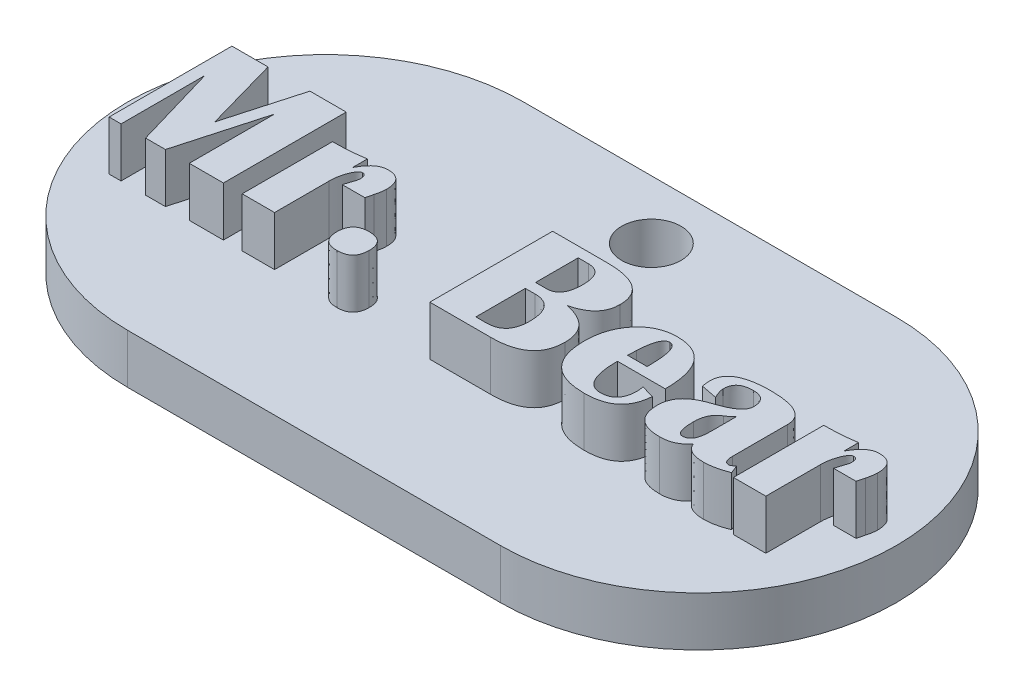
from build123d import *

# Parameters (mm, degrees)
BOSS_EXTRUDE1_DEPTH = 2.5
BOSS_EXTRUDE2_DEPTH = 2.5
SKETCH3_R           = 1.5
CUT_EXTRUDE1_DEPTH  = 5


with BuildPart() as part:
    # Sketch1 → Boss-Extrude1 (new body)
    with BuildSketch(Plane(origin=(0, 0, 0), x_dir=(1, 0, 0), z_dir=(0, 1, 0))):
        with BuildLine():
            Line((-9.422676429, 10), (9.422676429, 10))
            ThreePointArc((9.422676429, 10), (19.422676429, 0), (9.422676429, -10))
            Line((9.422676429, -10), (-9.422676429, -10))
            ThreePointArc((-9.422676429, -10), (-19.422676429, 0), (-9.422676429, 10))
        make_face()
    extrude(amount=BOSS_EXTRUDE1_DEPTH)

    # Sketch2 → Boss-Extrude2 (add)
    # profile 1 of 7: a face of its own
    with BuildSketch(Plane(origin=(0, 2.5, 0), x_dir=(1, 0, 0), z_dir=(0, 1, 0))):
        Polygon((-10.955316589, 2.576236371), (-10.955316589, -3.631136676), (-12.67958688, -3.631136676), (-12.67958688, 0.675497793), (-13.886576084, -3.631136676), (-14.88880819, -3.631136676), (-16.128127462, 0.60275514), (-16.128127462, -3.631136676), (-16.731622064, -3.631136676), (-16.731622064, 2.576236371), (-14.907667397, 2.576236371), (-13.846163499, -1.17809277), (-12.788700859, 2.576236371), align=None)
    # profile 2 of 7: a face of its own
    with BuildSketch(Plane(origin=(0, 2.5, 0), x_dir=(1, 0, 0), z_dir=(0, 1, 0))):
        with BuildLine():
            Line((-6.741631066, -0.699877181), (-7.877224703, -0.699877181))
            add(Edge.make_bspline(
                [(-7.877224703, -0.699877181), (-7.866266297, -0.657594595), (-7.845790087, -0.578587933), (-7.813482695, -0.470000398), (-7.783924156, -0.378768381), (-7.763776991, -0.324434196), (-7.754639862, -0.299792591)],
                knots=[0, 0, 0, 0, 1.251870671, 2.339169178, 3.246781061, 4, 4, 4, 4], degree=3))
            add(Edge.make_bspline(
                [(-7.754639862, -0.299792591), (-7.742697607, -0.269486036), (-7.719680733, -0.211074776), (-7.697870442, -0.122646379), (-7.681112749, -0.039539853), (-7.679822227, 0.014900048), (-7.679203037, 0.041020209)],
                knots=[0, 0, 0, 0, 1.111698743, 2.142629759, 3.108837303, 4, 4, 4, 4], degree=3))
            add(Edge.make_bspline(
                [(-7.679203037, 0.041020209), (-7.680158435, 0.063931728), (-7.681947024, 0.106824093), (-7.690334299, 0.167562968), (-7.708349143, 0.21853118), (-7.730203199, 0.262426953), (-7.763190598, 0.294385253), (-7.801882853, 0.317598334), (-7.847321597, 0.333448773), (-7.880226387, 0.334260548), (-7.897430996, 0.334684993)],
                knots=[0, 0, 0, 0, 1.321191862, 2.473386612, 3.512021293, 4.426346394, 5.267525488, 6.114646584, 7.014223539, 8, 8, 8, 8], degree=3))
            add(Edge.make_bspline(
                [(-7.897430996, 0.334684993), (-7.911595386, 0.333837006), (-7.940762009, 0.332090872), (-7.981879333, 0.31030395), (-8.02357568, 0.280354874), (-8.062789257, 0.235988851), (-8.104282682, 0.181902611), (-8.141784082, 0.113831675), (-8.18189658, 0.035383943), (-8.230640107, -0.08666944), (-8.285684574, -0.249179868), (-8.334860442, -0.452278728), (-8.36342281, -0.661337241), (-8.367074976, -0.802619619), (-8.368911153, -0.873651297)],
                knots=[0, 0, 0, 0, 0.36974167, 0.761354033, 1.201421396, 1.720285529, 2.311739729, 2.995477158, 3.762545601, 4.632445855, 6.4541632, 8.278912041, 10.129171368, 12, 12, 12, 12], degree=3))
            Line((-8.368911153, -0.873651297), (-8.368911153, -3.631136676))
            Line((-8.368911153, -3.631136676), (-10.006967929, -3.631136676))
            Line((-10.006967929, -3.631136676), (-10.006967929, 0.938179595))
            Line((-10.006967929, 0.938179595), (-9.687708508, 0.938179595))
            add(Edge.make_bspline(
                [(-9.687708508, 0.938179595), (-9.589789707, 0.940083265), (-9.385663946, 0.944051738), (-9.067423605, 0.966349628), (-8.725530989, 1.004287756), (-8.490486166, 1.039735307), (-8.368911153, 1.058070263)],
                knots=[0, 0, 0, 0, 0.886555129, 1.848151092, 2.886973752, 4, 4, 4, 4], degree=3))
            Line((-8.368911153, 1.058070263), (-8.368911153, 0.311784528))
            add(Edge.make_bspline(
                [(-8.368911153, 0.311784528), (-8.335163673, 0.374967931), (-8.270523242, 0.49599037), (-8.157440897, 0.657746918), (-8.041931227, 0.79754977), (-7.91906082, 0.911673641), (-7.78984828, 1.001717412), (-7.653649459, 1.063554207), (-7.512260039, 1.104287451), (-7.415451518, 1.108489578), (-7.366679047, 1.110606624)],
                knots=[0, 0, 0, 0, 1.271492001, 2.435434869, 3.499734799, 4.487660404, 5.405912591, 6.283991741, 7.135469055, 8, 8, 8, 8], degree=3))
            add(Edge.make_bspline(
                [(-7.366679047, 1.110606624), (-7.30306682, 1.108635746), (-7.182694934, 1.104906301), (-7.014998945, 1.060829917), (-6.871999996, 0.990544793), (-6.75425699, 0.890004991), (-6.664458768, 0.759754148), (-6.601238245, 0.602046015), (-6.563917038, 0.417236773), (-6.560331946, 0.285029898), (-6.558427348, 0.214794324)],
                knots=[0, 0, 0, 0, 1.102396871, 2.086039073, 2.985883286, 3.848703023, 4.744448623, 5.706110886, 6.781359763, 8, 8, 8, 8], degree=3))
            add(Edge.make_bspline(
                [(-6.558427348, 0.214794324), (-6.559537778, 0.173884013), (-6.561839726, 0.089075965), (-6.579172873, -0.04187984), (-6.606090984, -0.181360579), (-6.631458604, -0.276136838), (-6.644640862, -0.325387228)],
                knots=[0, 0, 0, 0, 0.894643577, 1.854617404, 2.885154048, 4, 4, 4, 4], degree=3))
            add(Edge.make_bspline(
                [(-6.644640862, -0.325387228), (-6.650500364, -0.348731), (-6.66357156, -0.40080557), (-6.68458333, -0.486826056), (-6.712281825, -0.587993964), (-6.731378273, -0.660792169), (-6.741631066, -0.699877181)],
                knots=[0, 0, 0, 0, 0.746575748, 1.665438207, 2.746584817, 4, 4, 4, 4], degree=3))
        make_face()
    # profile 3 of 7: a face of its own
    with BuildSketch(Plane(origin=(0, 2.5, 0), x_dir=(1, 0, 0), z_dir=(0, 1, 0))):
        with BuildLine():
            add(Edge.make_bspline(
                [(-5.135904358, -2.079293414), (-5.071417442, -2.080957857), (-4.950054454, -2.084090303), (-4.781097018, -2.124588156), (-4.635250998, -2.186245009), (-4.517800496, -2.280217941), (-4.423827564, -2.397668443), (-4.362170712, -2.543514463), (-4.321672859, -2.712471899), (-4.318540413, -2.833834886), (-4.31687597, -2.898321802)],
                knots=[0, 0, 0, 0, 1.162714133, 2.188202964, 3.121723856, 4, 4.878276144, 5.811797036, 6.837285867, 8, 8, 8, 8], degree=3))
            add(Edge.make_bspline(
                [(-4.31687597, -2.898321802), (-4.318657232, -2.962324235), (-4.322032737, -3.083609285), (-4.361489793, -3.252545475), (-4.424749706, -3.397871726), (-4.516785012, -3.516621154), (-4.6361708, -3.608414297), (-4.780425288, -3.673008939), (-4.950411479, -3.710235542), (-5.071497018, -3.714879823), (-5.135904358, -3.71735019)],
                knots=[0, 0, 0, 0, 1.155216392, 2.189142997, 3.115745179, 4.000869033, 4.874599507, 5.811952642, 6.83614253, 8, 8, 8, 8], degree=3))
            add(Edge.make_bspline(
                [(-5.135904358, -3.71735019), (-5.199828289, -3.714767133), (-5.320837161, -3.709877369), (-5.49080251, -3.673690187), (-5.634536029, -3.607490747), (-5.755218428, -3.517635872), (-5.845073302, -3.396953473), (-5.911272743, -3.253219955), (-5.947459925, -3.083254606), (-5.952349688, -2.962245733), (-5.954932746, -2.898321802)],
                knots=[0, 0, 0, 0, 1.156336832, 2.18896139, 3.119402066, 4, 4.880597934, 5.81103861, 6.843663168, 8, 8, 8, 8], degree=3))
            add(Edge.make_bspline(
                [(-5.954932746, -2.898321802), (-5.952462379, -2.833914463), (-5.947818098, -2.712828923), (-5.910591494, -2.542842733), (-5.845996853, -2.398588244), (-5.75420371, -2.279202456), (-5.635454282, -2.18716715), (-5.49012803, -2.123907238), (-5.321191841, -2.084450182), (-5.199906791, -2.081074677), (-5.135904358, -2.079293414)],
                knots=[0, 0, 0, 0, 1.16385747, 2.188047358, 3.125400493, 3.999130967, 4.884254821, 5.810857003, 6.844783608, 8, 8, 8, 8], degree=3))
        make_face()
    # profile 4 of 7: a face of its own
    with BuildSketch(Plane(origin=(0, 2.5, 0), x_dir=(1, 0, 0), z_dir=(0, 1, 0))):
        with BuildLine():
            Line((-0.52348133, -3.631136676), (-0.52348133, 2.576236371))
            Line((-0.52348133, 2.576236371), (2.246127825, 2.576236371))
            add(Edge.make_bspline(
                [(2.246127825, 2.576236371), (2.332822825, 2.575382109), (2.500566459, 2.573729223), (2.74387325, 2.555949905), (2.970705977, 2.526966301), (3.180807769, 2.48522823), (3.374424062, 2.433519855), (3.550795245, 2.368709733), (3.710809607, 2.292027457), (3.85412061, 2.203170756), (3.981133613, 2.102756161), (4.091164296, 1.990058123), (4.185090561, 1.865445831), (4.260752136, 1.728327008), (4.319023837, 1.579653141), (4.360348188, 1.419555262), (4.386792733, 1.247538514), (4.389365224, 1.128668872), (4.390688999, 1.067499867)],
                knots=[0, 0, 0, 0, 1.395221753, 2.699573992, 3.924173681, 5.073721882, 6.145013494, 7.146600138, 8.09374359, 8.996236064, 9.855223683, 10.693435575, 11.524606832, 12.359290184, 13.206182017, 14.087975928, 15.016093518, 16, 16, 16, 16], degree=3))
            add(Edge.make_bspline(
                [(4.390688999, 1.067499867), (4.389552714, 1.023908944), (4.387320338, 0.938269068), (4.372787543, 0.812804786), (4.346683481, 0.693515252), (4.311955026, 0.579593326), (4.266203862, 0.471516011), (4.209235688, 0.370214296), (4.142551889, 0.275300672), (4.066683142, 0.185694365), (3.980285357, 0.101943664), (3.882898004, 0.025328437), (3.775699365, -0.044719298), (3.659176494, -0.109642232), (3.532441779, -0.169164126), (3.394653214, -0.220743878), (3.247546167, -0.268895806), (3.144831359, -0.293761871), (3.092097936, -0.306528021)],
                knots=[0, 0, 0, 0, 1.011382104, 1.986987923, 2.924876173, 3.840928976, 4.746495918, 5.641999688, 6.532154942, 7.433878611, 8.3621711, 9.318848767, 10.304140316, 11.330171245, 12.411412872, 13.549050058, 14.741690871, 16, 16, 16, 16], degree=3))
            add(Edge.make_bspline(
                [(3.092097936, -0.306528021), (3.155148122, -0.320135927), (3.278082854, -0.34666851), (3.454850356, -0.398189553), (3.619702642, -0.457170987), (3.772398729, -0.524557007), (3.9129344, -0.599522436), (4.040622359, -0.683911553), (4.156379775, -0.775441327), (4.262054794, -0.874192833), (4.353040994, -0.983286627), (4.43184152, -1.100557978), (4.499534713, -1.224809238), (4.55536055, -1.357298033), (4.596211053, -1.498616065), (4.62804701, -1.647015615), (4.644884213, -1.804104079), (4.647825694, -1.911322285), (4.649329542, -1.966138176)],
                knots=[0, 0, 0, 0, 1.235430986, 2.408833129, 3.52452697, 4.587536939, 5.603669279, 6.572374558, 7.515532169, 8.42830491, 9.338113503, 10.230469559, 11.131245034, 12.045111669, 12.978687021, 13.945442232, 14.949596169, 16, 16, 16, 16], degree=3))
            add(Edge.make_bspline(
                [(4.649329542, -1.966138176), (4.647829457, -2.033557437), (4.644918896, -2.164368609), (4.620999259, -2.354129966), (4.578443148, -2.530218433), (4.522931506, -2.694600979), (4.448210031, -2.845191541), (4.356869329, -2.982061455), (4.251451448, -3.107695511), (4.12751548, -3.218963516), (3.986207771, -3.315272034), (3.830212307, -3.401482255), (3.656950747, -3.47152895), (3.468483485, -3.531607478), (3.263247588, -3.576593406), (3.041755409, -3.608569403), (2.804140991, -3.62719962), (2.64040835, -3.629796992), (2.555957642, -3.631136676)],
                knots=[0, 0, 0, 0, 1.058454713, 2.05368167, 2.995976372, 3.89904755, 4.7724843, 5.627048632, 6.477472636, 7.34115065, 8.233004837, 9.157537641, 10.134336842, 11.162317281, 12.260511776, 13.429147083, 14.673994716, 16, 16, 16, 16], degree=3))
            Line((2.555957642, -3.631136676), (-0.52348133, -3.631136676))
        make_face()
        with BuildLine():
            Line((1.287002475, -3.113855589), (1.800242304, -3.113855589))
            add(Edge.make_bspline(
                [(1.800242304, -3.113855589), (1.842069112, -3.11342192), (1.923761243, -3.112574919), (2.04145043, -3.096141076), (2.152169243, -3.07643685), (2.25350997, -3.042588066), (2.348705429, -3.003707741), (2.433788941, -2.951276792), (2.511119134, -2.891822083), (2.581366489, -2.823880639), (2.641075941, -2.744728447), (2.696120518, -2.658617292), (2.740132986, -2.56173004), (2.776297491, -2.45656122), (2.804632231, -2.342513372), (2.824464839, -2.219514112), (2.836726435, -2.087176043), (2.83812412, -1.995801989), (2.838845737, -1.948626056)],
                knots=[0, 0, 0, 0, 1.120905114, 2.189244953, 3.183863851, 4.1324809, 5.049913265, 5.936209845, 6.80363985, 7.664014729, 8.548344309, 9.457514211, 10.400684904, 11.395011954, 12.438058803, 13.549081035, 14.73460373, 16, 16, 16, 16], degree=3))
            add(Edge.make_bspline(
                [(2.838845737, -1.948626056), (2.838091751, -1.894722619), (2.836631998, -1.790362902), (2.824787712, -1.638635655), (2.803246005, -1.497347979), (2.773938134, -1.366207082), (2.736356056, -1.245783949), (2.690754269, -1.135935677), (2.636284243, -1.036802828), (2.574717861, -0.946741696), (2.502156906, -0.868523433), (2.423105502, -0.798900255), (2.333601975, -0.741985223), (2.23689656, -0.69488647), (2.131427887, -0.658489444), (2.018340256, -0.63113461), (1.896242145, -0.617019238), (1.812397092, -0.614803599), (1.769259322, -0.613663667)],
                knots=[0, 0, 0, 0, 1.323083726, 2.561555464, 3.732251659, 4.828564274, 5.856947052, 6.825212996, 7.742712182, 8.629438628, 9.495439932, 10.355034406, 11.208031523, 12.090431611, 12.989809699, 13.941560732, 14.940945512, 16, 16, 16, 16], degree=3))
            Line((1.769259322, -0.613663667), (1.287002475, -0.613663667))
            Line((1.287002475, -0.613663667), (1.287002475, -3.113855589))
        make_face(mode=Mode.SUBTRACT)
        with BuildLine():
            Line((1.287002475, -0.09638258), (1.842001975, -0.09638258))
            add(Edge.make_bspline(
                [(1.842001975, -0.09638258), (1.871701232, -0.095786201), (1.929631205, -0.094622933), (2.013546624, -0.080347526), (2.09256161, -0.05938996), (2.165320779, -0.028123997), (2.232698496, 0.011284013), (2.293215902, 0.060514273), (2.34940758, 0.117140419), (2.397471952, 0.184184444), (2.441021888, 0.258938013), (2.478683765, 0.342396605), (2.509022468, 0.435300095), (2.536352735, 0.535785166), (2.556502293, 0.645727911), (2.568714475, 0.764215291), (2.579331552, 0.891296013), (2.579907336, 0.979015291), (2.580205193, 1.024393109)],
                knots=[0, 0, 0, 0, 0.936237286, 1.826180431, 2.678785862, 3.510527459, 4.317391414, 5.134026898, 5.965768496, 6.827393977, 7.729105662, 8.693135518, 9.710376575, 10.810325032, 11.977674089, 13.232728636, 14.568470462, 16, 16, 16, 16], degree=3))
            add(Edge.make_bspline(
                [(2.580205193, 1.024393109), (2.579860665, 1.066176086), (2.579192869, 1.147163616), (2.569155081, 1.264486556), (2.555046061, 1.37396637), (2.533649746, 1.475400592), (2.505239577, 1.568531992), (2.471656134, 1.653788324), (2.432762594, 1.731421301), (2.386766001, 1.800779533), (2.33387362, 1.861477483), (2.27552595, 1.915009179), (2.210404114, 1.959322932), (2.139539329, 1.996293578), (2.062067448, 2.024549851), (1.978423799, 2.044390837), (1.889070735, 2.056798415), (1.827674718, 2.058224318), (1.796201046, 2.058955284)],
                knots=[0, 0, 0, 0, 1.353611409, 2.623691588, 3.813190064, 4.929118241, 5.978650588, 6.96494404, 7.895563882, 8.787494868, 9.654017719, 10.49876267, 11.34638538, 12.198989754, 13.082931891, 14.011159537, 14.98045319, 16, 16, 16, 16], degree=3))
            Line((1.796201046, 2.058955284), (1.287002475, 2.058955284))
            Line((1.287002475, 2.058955284), (1.287002475, -0.09638258))
        make_face(mode=Mode.SUBTRACT)
    # profile 5 of 7: a face of its own
    with BuildSketch(Plane(origin=(0, 2.5, 0), x_dir=(1, 0, 0), z_dir=(0, 1, 0))):
        with BuildLine():
            Line((8.563961937, -1.94727897), (9.232116675, -2.142606464))
            add(Edge.make_bspline(
                [(9.232116675, -2.142606464), (9.226921156, -2.206497515), (9.216840505, -2.330462683), (9.184114141, -2.509440487), (9.138253228, -2.675670009), (9.080669676, -2.830390414), (9.00905866, -2.972849118), (8.923649491, -3.102670309), (8.826144204, -3.221094773), (8.715352912, -3.326554449), (8.590864025, -3.41867213), (8.454668284, -3.500247525), (8.304070069, -3.566899295), (8.14137171, -3.622467776), (7.965484815, -3.665118978), (7.776851474, -3.696098446), (7.57506, -3.71302501), (7.436480526, -3.715879142), (7.36505525, -3.71735019)],
                knots=[0, 0, 0, 0, 1.114273246, 2.161978372, 3.158522875, 4.109988094, 5.028482894, 5.925174044, 6.807053034, 7.690831623, 8.5779505, 9.495349145, 10.446044933, 11.436327975, 12.48181894, 13.589753007, 14.757734088, 16, 16, 16, 16], degree=3))
            add(Edge.make_bspline(
                [(7.36505525, -3.71735019), (7.272935864, -3.715552004), (7.094122513, -3.712061536), (6.834693593, -3.684821569), (6.592698692, -3.640807513), (6.367958503, -3.579814165), (6.161865309, -3.49828506), (5.972735264, -3.40009126), (5.802130503, -3.281937705), (5.648607883, -3.146860761), (5.514339381, -2.992915403), (5.397844308, -2.821899759), (5.299070886, -2.632917435), (5.217991219, -2.425687033), (5.157110671, -2.200071424), (5.112785886, -1.957233203), (5.085714984, -1.696881824), (5.082205073, -1.517176123), (5.080397115, -1.424609538)],
                knots=[0, 0, 0, 0, 1.190660372, 2.311196165, 3.367750207, 4.367645234, 5.316214737, 6.227573681, 7.116377919, 7.992274793, 8.864335619, 9.749854554, 10.661213498, 11.615184669, 12.620674803, 13.677228845, 14.803538277, 16, 16, 16, 16], degree=3))
            add(Edge.make_bspline(
                [(5.080397115, -1.424609538), (5.082093699, -1.333822702), (5.085411522, -1.156280884), (5.114763144, -0.896013909), (5.160562415, -0.647771947), (5.228875154, -0.412895815), (5.313174821, -0.18984254), (5.4194274, 0.019122065), (5.542012703, 0.217594143), (5.684386614, 0.400780649), (5.840708694, 0.56704325), (6.009091535, 0.713086138), (6.188542334, 0.836001531), (6.378927938, 0.936461501), (6.579353003, 1.015493103), (6.791133246, 1.069985265), (7.013188713, 1.105126923), (7.165100857, 1.108757536), (7.242470409, 1.110606624)],
                knots=[0, 0, 0, 0, 1.167411652, 2.282978421, 3.364781042, 4.410439903, 5.42515749, 6.427370907, 7.421026527, 8.421507566, 9.406192312, 10.352172219, 11.282954317, 12.197575335, 13.115691177, 14.047315149, 15.005488641, 16, 16, 16, 16], degree=3))
            add(Edge.make_bspline(
                [(7.242470409, 1.110606624), (7.322521038, 1.109177305), (7.478325729, 1.106395383), (7.70369173, 1.073905161), (7.914410192, 1.025768166), (8.108206004, 0.952974985), (8.288330336, 0.863047864), (8.451623177, 0.750231495), (8.600657466, 0.618216707), (8.732431009, 0.464999187), (8.849738244, 0.292227741), (8.948396774, 0.098298177), (9.033800395, -0.114875953), (9.103259196, -0.348029587), (9.156646922, -0.601764836), (9.195306753, -0.874904102), (9.218082505, -1.168725393), (9.221117622, -1.371134), (9.222687071, -1.475798812)],
                knots=[0, 0, 0, 0, 1.032658436, 2.009890901, 2.93366693, 3.817738276, 4.675866232, 5.52646186, 6.372303307, 7.23939144, 8.128522839, 9.061907187, 10.042572403, 11.089772398, 12.198328492, 13.387060978, 14.648857986, 16, 16, 16, 16], degree=3))
            Line((9.222687071, -1.475798812), (6.804667406, -1.475798812))
            add(Edge.make_bspline(
                [(6.804667406, -1.475798812), (6.805476403, -1.54900597), (6.80704072, -1.690562836), (6.81807855, -1.895899007), (6.834763933, -2.087045105), (6.860215109, -2.264278322), (6.893643251, -2.427110828), (6.934114925, -2.576035025), (6.98026981, -2.711342279), (7.036048294, -2.831891093), (7.097455477, -2.938951999), (7.166748313, -3.032033523), (7.243564731, -3.110761786), (7.328463934, -3.175191609), (7.420512221, -3.225632509), (7.520677641, -3.260572673), (7.62763651, -3.28300935), (7.70171106, -3.28517599), (7.739545204, -3.286282618)],
                knots=[0, 0, 0, 0, 1.546283237, 2.98996733, 4.34244041, 5.597949141, 6.769849071, 7.851281965, 8.856177864, 9.785590879, 10.652658763, 11.458866246, 12.230173047, 12.968099767, 13.702360051, 14.437355085, 15.201867131, 16, 16, 16, 16], degree=3))
            add(Edge.make_bspline(
                [(7.739545204, -3.286282618), (7.775061438, -3.285589272), (7.843621132, -3.284250853), (7.94320047, -3.271603495), (8.035957572, -3.252270009), (8.121625565, -3.222846423), (8.201924862, -3.189214308), (8.273310684, -3.143498685), (8.339497893, -3.091885431), (8.398148826, -3.03146998), (8.450544061, -2.962924448), (8.494102831, -2.885896201), (8.533062519, -2.801620907), (8.561159281, -2.708298087), (8.586039621, -2.608210099), (8.603569107, -2.500121025), (8.612253189, -2.383877794), (8.614164609, -2.303819955), (8.615151211, -2.262497133)],
                knots=[0, 0, 0, 0, 1.104386112, 2.131880741, 3.118289829, 4.045974163, 4.946655037, 5.818826445, 6.674052097, 7.553243331, 8.430545859, 9.350626095, 10.300963018, 11.3126675, 12.376553086, 13.508772399, 14.714122696, 16, 16, 16, 16], degree=3))
            add(Edge.make_bspline(
                [(8.615151211, -2.262497133), (8.612791706, -2.212840006), (8.607709719, -2.10588674), (8.579222748, -2.002607103), (8.563961937, -1.94727897)],
                knots=[0, 0, 0, 0, 0.928576148, 2, 2, 2, 2], degree=3))
        make_face()
        with BuildLine():
            Line((6.799279061, -0.958517725), (7.790734478, -0.958517725))
            add(Edge.make_bspline(
                [(7.790734478, -0.958517725), (7.79074272, -0.892502797), (7.790758703, -0.76447544), (7.783302294, -0.579007192), (7.773804774, -0.406133452), (7.763043402, -0.245985693), (7.744296437, -0.098877391), (7.725943153, 0.035975129), (7.698691844, 0.157171335), (7.673689354, 0.266855041), (7.640845132, 0.363049557), (7.604972403, 0.446517958), (7.565875603, 0.517806748), (7.523209113, 0.576697123), (7.475140241, 0.62224132), (7.423407243, 0.655774956), (7.366833102, 0.675311298), (7.327924268, 0.678130176), (7.308477631, 0.679539051)],
                knots=[0, 0, 0, 0, 1.736722994, 3.368148059, 4.88262128, 6.292522419, 7.589393167, 8.784027053, 9.870737941, 10.856424848, 11.741857193, 12.540778073, 13.244192531, 13.877436386, 14.445745797, 14.976726644, 15.488567922, 16, 16, 16, 16], degree=3))
            add(Edge.make_bspline(
                [(7.308477631, 0.679539051), (7.29091, 0.678244966), (7.255734777, 0.675653853), (7.203925881, 0.662698187), (7.156591519, 0.637413851), (7.111958594, 0.603908304), (7.070503241, 0.560796181), (7.032851988, 0.507236497), (6.998249574, 0.445144539), (6.965490555, 0.374122063), (6.936091112, 0.293525356), (6.911037935, 0.202798658), (6.888185798, 0.103002316), (6.868160105, -0.006238224), (6.850751834, -0.125311334), (6.835863953, -0.253753642), (6.825442269, -0.391738909), (6.820624961, -0.486577182), (6.818138268, -0.535532669)],
                knots=[0, 0, 0, 0, 0.59771954, 1.196798639, 1.796846965, 2.406693431, 3.085960836, 3.817935392, 4.623533109, 5.496700367, 6.471024336, 7.532796631, 8.690401049, 9.946336871, 11.302559863, 12.775768307, 14.335652571, 16, 16, 16, 16], degree=3))
            Line((6.818138268, -0.535532669), (6.799279061, -0.958517725))
        make_face(mode=Mode.SUBTRACT)
    # profile 6 of 7: a face of its own
    with BuildSketch(Plane(origin=(0, 2.5, 0), x_dir=(1, 0, 0), z_dir=(0, 1, 0))):
        with BuildLine():
            add(Edge.make_bspline(
                [(14.565230801, -3.466792164), (14.465738024, -3.505097069), (14.271241573, -3.579978566), (13.973744966, -3.657674036), (13.680530568, -3.707462618), (13.485507764, -3.714082125), (13.389224579, -3.71735019)],
                knots=[0, 0, 0, 0, 1.056879314, 2.066072368, 3.0452157, 4, 4, 4, 4], degree=3))
            add(Edge.make_bspline(
                [(13.389224579, -3.71735019), (13.321778151, -3.716090176), (13.193525544, -3.713694199), (13.010908921, -3.687930175), (12.848632307, -3.645738676), (12.705664889, -3.58622836), (12.582754439, -3.509587562), (12.480966813, -3.414154922), (12.397293011, -3.302687355), (12.361864897, -3.216742814), (12.343885715, -3.17312738)],
                knots=[0, 0, 0, 0, 1.282268188, 2.438294246, 3.499107553, 4.463668342, 5.373621945, 6.237846899, 7.105736429, 8, 8, 8, 8], degree=3))
            add(Edge.make_bspline(
                [(12.343885715, -3.17312738), (12.309007137, -3.21671562), (12.240349276, -3.302518296), (12.120221247, -3.414014621), (11.988392363, -3.507237085), (11.84624305, -3.584889352), (11.692094768, -3.644219882), (11.52724083, -3.687205494), (11.351017565, -3.713300961), (11.229936245, -3.7159781), (11.167879493, -3.71735019)],
                knots=[0, 0, 0, 0, 0.993684051, 1.956049413, 2.908452201, 3.864343655, 4.834559242, 5.843680893, 6.89484061, 8, 8, 8, 8], degree=3))
            add(Edge.make_bspline(
                [(11.167879493, -3.71735019), (11.109907896, -3.716432793), (10.997766301, -3.714658158), (10.835364139, -3.697723056), (10.683833326, -3.672993372), (10.543111502, -3.636608881), (10.413303734, -3.589919494), (10.294959766, -3.531535437), (10.1881704, -3.462940247), (10.092596867, -3.383492133), (10.007148721, -3.294708575), (9.933763212, -3.194088483), (9.873437944, -3.08202918), (9.821920303, -2.96101507), (9.782643322, -2.829066918), (9.756995365, -2.686695236), (9.738250895, -2.534202298), (9.736717501, -2.428700704), (9.7359269, -2.374305284)],
                knots=[0, 0, 0, 0, 1.235120868, 2.38924627, 3.476397774, 4.504669834, 5.482542067, 6.411274067, 7.311157636, 8.181131531, 9.05431034, 9.930995801, 10.82613438, 11.761058323, 12.729945035, 13.752859149, 14.841399769, 16, 16, 16, 16], degree=3))
            add(Edge.make_bspline(
                [(9.7359269, -2.374305284), (9.737038822, -2.332503565), (9.739221946, -2.250430893), (9.754182541, -2.129527893), (9.779730511, -2.013111014), (9.816273937, -1.901399032), (9.862147795, -1.79447141), (9.917928034, -1.692454117), (9.983870618, -1.595131317), (10.061665951, -1.503686046), (10.147731738, -1.415368393), (10.245783098, -1.333271964), (10.35330112, -1.255299202), (10.470895053, -1.182543075), (10.598451537, -1.115051935), (10.736178784, -1.051962824), (10.88388518, -0.992434217), (10.987163449, -0.95839102), (11.039906308, -0.941005605)],
                knots=[0, 0, 0, 0, 0.958959357, 1.882801888, 2.790126755, 3.689285561, 4.575305972, 5.455859481, 6.353068664, 7.26715253, 8.206883801, 9.179032903, 10.19699077, 11.25186367, 12.348710126, 13.505688165, 14.726187642, 16, 16, 16, 16], degree=3))
            add(Edge.make_bspline(
                [(11.039906308, -0.941005605), (11.133722404, -0.909369802), (11.311085231, -0.849561138), (11.555026971, -0.747870259), (11.762697983, -0.64215815), (11.932437026, -0.52974575), (12.066039081, -0.412087603), (12.164346605, -0.290184101), (12.224516429, -0.158914616), (12.232297136, -0.068197747), (12.236118822, -0.023639927)],
                knots=[0, 0, 0, 0, 1.488797015, 2.814626232, 3.971579162, 4.988716818, 5.868735512, 6.638787967, 7.331407237, 8, 8, 8, 8], degree=3))
            add(Edge.make_bspline(
                [(12.236118822, -0.023639927), (12.234418418, 0.031327678), (12.231203333, 0.135259174), (12.197599683, 0.280989285), (12.140551646, 0.405126434), (12.060896644, 0.509036537), (11.955249877, 0.586668172), (11.828007603, 0.640852255), (11.679718999, 0.674721949), (11.573102013, 0.677873856), (11.51677481, 0.679539051)],
                knots=[0, 0, 0, 0, 1.142637826, 2.160473586, 3.088677903, 3.967383079, 4.855235242, 5.784239067, 6.829383386, 8, 8, 8, 8], degree=3))
            add(Edge.make_bspline(
                [(11.51677481, 0.679539051), (11.451503888, 0.677798506), (11.329024189, 0.674532404), (11.157626616, 0.642137194), (11.011590836, 0.589733574), (10.890609073, 0.513765247), (10.796131806, 0.414577541), (10.730993756, 0.291958652), (10.690905354, 0.149009559), (10.686570698, 0.046697742), (10.68427556, -0.007474893)],
                knots=[0, 0, 0, 0, 1.268973575, 2.381205858, 3.379395825, 4.271425461, 5.136821322, 6.012741233, 6.947775072, 8, 8, 8, 8], degree=3))
            add(Edge.make_bspline(
                [(10.68427556, -0.007474893), (10.687203161, -0.046261467), (10.693587822, -0.130849213), (10.730033443, -0.265279528), (10.789115969, -0.416034538), (10.840155398, -0.520187255), (10.867479279, -0.575945254)],
                knots=[0, 0, 0, 0, 0.774171244, 1.688352274, 2.762462888, 4, 4, 4, 4], degree=3))
            Line((10.867479279, -0.575945254), (10.044409632, -0.416989087))
            add(Edge.make_bspline(
                [(10.044409632, -0.416989087), (10.029706135, -0.346745941), (10.001424145, -0.211634134), (9.996791586, -0.073699043), (9.994567444, -0.007474893)],
                knots=[0, 0, 0, 0, 1.039778055, 2, 2, 2, 2], degree=3))
            add(Edge.make_bspline(
                [(9.994567444, -0.007474893), (9.996157576, 0.037968214), (9.999248995, 0.126315352), (10.022136619, 0.254335018), (10.061880657, 0.372854648), (10.116037866, 0.483429864), (10.186710641, 0.585270442), (10.273863873, 0.677375486), (10.376771669, 0.759508564), (10.492538172, 0.836090866), (10.626436479, 0.8999024), (10.774801457, 0.95609242), (10.938555632, 1.004920262), (11.11800622, 1.042852986), (11.31259672, 1.074324412), (11.52271892, 1.094690279), (11.748276859, 1.108924808), (11.903812692, 1.110033506), (11.984213709, 1.110606624)],
                knots=[0, 0, 0, 0, 0.851624305, 1.655665189, 2.427562795, 3.187947522, 3.956118909, 4.74211419, 5.555833429, 6.419641229, 7.338145349, 8.329219093, 9.391807277, 10.537582445, 11.765005819, 13.084959286, 14.493130256, 16, 16, 16, 16], degree=3))
            add(Edge.make_bspline(
                [(11.984213709, 1.110606624), (12.06055949, 1.109829558), (12.208414196, 1.108324657), (12.422933455, 1.096826122), (12.622317546, 1.074498638), (12.807560448, 1.047749398), (12.977258045, 1.009178235), (13.133258026, 0.966012364), (13.273730784, 0.911824443), (13.399980687, 0.850249594), (13.511317702, 0.779504195), (13.609747006, 0.702078465), (13.690733855, 0.613425308), (13.758141127, 0.517651353), (13.811126969, 0.413984212), (13.847145517, 0.301073803), (13.871320094, 0.180803824), (13.873208438, 0.09727326), (13.874175598, 0.054491071)],
                knots=[0, 0, 0, 0, 1.50926466, 2.922910493, 4.244308801, 5.474613126, 6.620353895, 7.682365775, 8.671464678, 9.592456737, 10.454360259, 11.275054007, 12.060273444, 12.818746299, 13.584919584, 14.351247116, 15.155551521, 16, 16, 16, 16], degree=3))
            Line((13.874175598, 0.054491071), (13.874175598, -2.720506429))
            add(Edge.make_bspline(
                [(13.874175598, -2.720506429), (13.874713694, -2.757832509), (13.875729164, -2.828272519), (13.889274155, -2.926204929), (13.909590608, -3.010281641), (13.940999947, -3.078286823), (13.978695025, -3.134165071), (14.028676968, -3.173003921), (14.087992607, -3.195273575), (14.12993403, -3.198431907), (14.151675348, -3.200069103)],
                knots=[0, 0, 0, 0, 1.438880701, 2.715387445, 3.807936607, 4.761419332, 5.593180532, 6.383303817, 7.161947702, 8, 8, 8, 8], degree=3))
            add(Edge.make_bspline(
                [(14.151675348, -3.200069103), (14.168111065, -3.197787619), (14.20599273, -3.192529167), (14.263901788, -3.159766278), (14.333547749, -3.114155735), (14.380293367, -3.073267991), (14.406274633, -3.050542539)],
                knots=[0, 0, 0, 0, 0.659262562, 1.519493412, 2.621331725, 4, 4, 4, 4], degree=3))
            Line((14.406274633, -3.050542539), (14.565230801, -3.466792164))
        make_face()
        with BuildLine():
            add(Edge.make_bspline(
                [(12.236118822, -0.884427986), (12.183494677, -0.941777173), (12.078322459, -1.056392645), (11.947299337, -1.14024045), (11.881835161, -1.182134028)],
                knots=[0, 0, 0, 0, 1.000723297, 2, 2, 2, 2], degree=3))
            add(Edge.make_bspline(
                [(11.881835161, -1.182134028), (11.841549833, -1.208479652), (11.762112498, -1.260429735), (11.65727443, -1.355884937), (11.569173474, -1.464653114), (11.496388435, -1.586421758), (11.441887768, -1.721634229), (11.402996683, -1.86919346), (11.378100644, -2.029061589), (11.375388058, -2.140264259), (11.373983676, -2.197836997)],
                knots=[0, 0, 0, 0, 0.967677045, 1.908131107, 2.839684773, 3.775830093, 4.752580097, 5.763193974, 6.841942867, 8, 8, 8, 8], degree=3))
            add(Edge.make_bspline(
                [(11.373983676, -2.197836997), (11.374939459, -2.269252506), (11.376727657, -2.402865508), (11.391579613, -2.589559361), (11.419938037, -2.74763504), (11.455037964, -2.878931406), (11.504997609, -2.98112662), (11.564605101, -3.057367489), (11.640242652, -3.105335677), (11.696220663, -3.111014508), (11.724226079, -3.113855589)],
                knots=[0, 0, 0, 0, 1.606661438, 3.005941722, 4.206714796, 5.21687408, 6.052624467, 6.748462188, 7.373864194, 8, 8, 8, 8], degree=3))
            add(Edge.make_bspline(
                [(11.724226079, -3.113855589), (11.764660673, -3.111237713), (11.842692609, -3.106185656), (11.95105391, -3.060039736), (12.043486103, -2.986284125), (12.11458199, -2.880200079), (12.171360997, -2.748895644), (12.20816028, -2.588325651), (12.232439154, -2.400648156), (12.23483911, -2.265734682), (12.236118822, -2.193795738)],
                knots=[0, 0, 0, 0, 0.819770896, 1.582019392, 2.355801278, 3.195313958, 4.153195118, 5.255097872, 6.536355541, 8, 8, 8, 8], degree=3))
            Line((12.236118822, -2.193795738), (12.236118822, -0.884427986))
        make_face(mode=Mode.SUBTRACT)
    # profile 7 of 7: a face of its own
    with BuildSketch(Plane(origin=(0, 2.5, 0), x_dir=(1, 0, 0), z_dir=(0, 1, 0))):
        with BuildLine():
            Line((18.087861121, -0.699877181), (16.952267484, -0.699877181))
            add(Edge.make_bspline(
                [(16.952267484, -0.699877181), (16.963225891, -0.657594595), (16.9837021, -0.578587933), (17.016009493, -0.470000398), (17.045568032, -0.378768381), (17.065715196, -0.324434196), (17.074852325, -0.299792591)],
                knots=[0, 0, 0, 0, 1.251870671, 2.339169178, 3.246781061, 4, 4, 4, 4], degree=3))
            add(Edge.make_bspline(
                [(17.074852325, -0.299792591), (17.08679458, -0.269486036), (17.109811455, -0.211074776), (17.131621745, -0.122646379), (17.148379438, -0.039539853), (17.149669961, 0.014900048), (17.150289151, 0.041020209)],
                knots=[0, 0, 0, 0, 1.111698743, 2.142629759, 3.108837303, 4, 4, 4, 4], degree=3))
            add(Edge.make_bspline(
                [(17.150289151, 0.041020209), (17.149333752, 0.063931728), (17.147545163, 0.106824093), (17.139157888, 0.167562968), (17.121143045, 0.21853118), (17.099288989, 0.262426953), (17.06630159, 0.294385253), (17.027609334, 0.317598334), (16.98217059, 0.333448773), (16.9492658, 0.334260548), (16.932061192, 0.334684993)],
                knots=[0, 0, 0, 0, 1.321191862, 2.473386612, 3.512021293, 4.426346394, 5.267525488, 6.114646584, 7.014223539, 8, 8, 8, 8], degree=3))
            add(Edge.make_bspline(
                [(16.932061192, 0.334684993), (16.917896801, 0.333837006), (16.888730178, 0.332090872), (16.847612855, 0.31030395), (16.805916507, 0.280354874), (16.766702931, 0.235988851), (16.725209505, 0.181902611), (16.687708106, 0.113831675), (16.647595608, 0.035383943), (16.59885208, -0.08666944), (16.543807614, -0.249179868), (16.494631746, -0.452278728), (16.466069378, -0.661337241), (16.462417212, -0.802619619), (16.460581034, -0.873651297)],
                knots=[0, 0, 0, 0, 0.36974167, 0.761354033, 1.201421396, 1.720285529, 2.311739729, 2.995477158, 3.762545601, 4.632445855, 6.4541632, 8.278912041, 10.129171368, 12, 12, 12, 12], degree=3))
            Line((16.460581034, -0.873651297), (16.460581034, -3.631136676))
            Line((16.460581034, -3.631136676), (14.822524258, -3.631136676))
            Line((14.822524258, -3.631136676), (14.822524258, 0.938179595))
            Line((14.822524258, 0.938179595), (15.141783679, 0.938179595))
            add(Edge.make_bspline(
                [(15.141783679, 0.938179595), (15.239702481, 0.940083265), (15.443828241, 0.944051738), (15.762068583, 0.966349628), (16.103961198, 1.004287756), (16.339006022, 1.039735307), (16.460581034, 1.058070263)],
                knots=[0, 0, 0, 0, 0.886555129, 1.848151092, 2.886973752, 4, 4, 4, 4], degree=3))
            Line((16.460581034, 1.058070263), (16.460581034, 0.311784528))
            add(Edge.make_bspline(
                [(16.460581034, 0.311784528), (16.494328515, 0.374967931), (16.558968946, 0.49599037), (16.672051291, 0.657746918), (16.787560961, 0.79754977), (16.910431368, 0.911673641), (17.039643907, 1.001717412), (17.175842729, 1.063554207), (17.317232148, 1.104287451), (17.41404067, 1.108489578), (17.462813141, 1.110606624)],
                knots=[0, 0, 0, 0, 1.271492001, 2.435434869, 3.499734799, 4.487660404, 5.405912591, 6.283991741, 7.135469055, 8, 8, 8, 8], degree=3))
            add(Edge.make_bspline(
                [(17.462813141, 1.110606624), (17.526425367, 1.108635746), (17.646797253, 1.104906301), (17.814493242, 1.060829917), (17.957492192, 0.990544793), (18.075235197, 0.890004991), (18.16503342, 0.759754148), (18.228253943, 0.602046015), (18.26557515, 0.417236773), (18.269160241, 0.285029898), (18.27106484, 0.214794324)],
                knots=[0, 0, 0, 0, 1.102396871, 2.086039073, 2.985883286, 3.848703023, 4.744448623, 5.706110886, 6.781359763, 8, 8, 8, 8], degree=3))
            add(Edge.make_bspline(
                [(18.27106484, 0.214794324), (18.26995441, 0.173884013), (18.267652461, 0.089075965), (18.250319314, -0.04187984), (18.223401203, -0.181360579), (18.198033584, -0.276136838), (18.184851325, -0.325387228)],
                knots=[0, 0, 0, 0, 0.894643577, 1.854617404, 2.885154048, 4, 4, 4, 4], degree=3))
            add(Edge.make_bspline(
                [(18.184851325, -0.325387228), (18.178991823, -0.348731), (18.165920627, -0.40080557), (18.144908857, -0.486826056), (18.117210362, -0.587993964), (18.098113914, -0.660792169), (18.087861121, -0.699877181)],
                knots=[0, 0, 0, 0, 0.746575748, 1.665438207, 2.746584817, 4, 4, 4, 4], degree=3))
        make_face()
    extrude(amount=BOSS_EXTRUDE2_DEPTH)

    # Sketch3 → Cut-Extrude1 (cut)
    with BuildSketch(Plane(origin=(0, 2.5, 0), x_dir=(1, 0, 0), z_dir=(0, 1, 0))):
        with Locations(Location((0, 7.041714459, 0), (0, 0, 270))):
            Circle(SKETCH3_R)
    extrude(amount=-CUT_EXTRUDE1_DEPTH, mode=Mode.SUBTRACT)


solid = part.part
